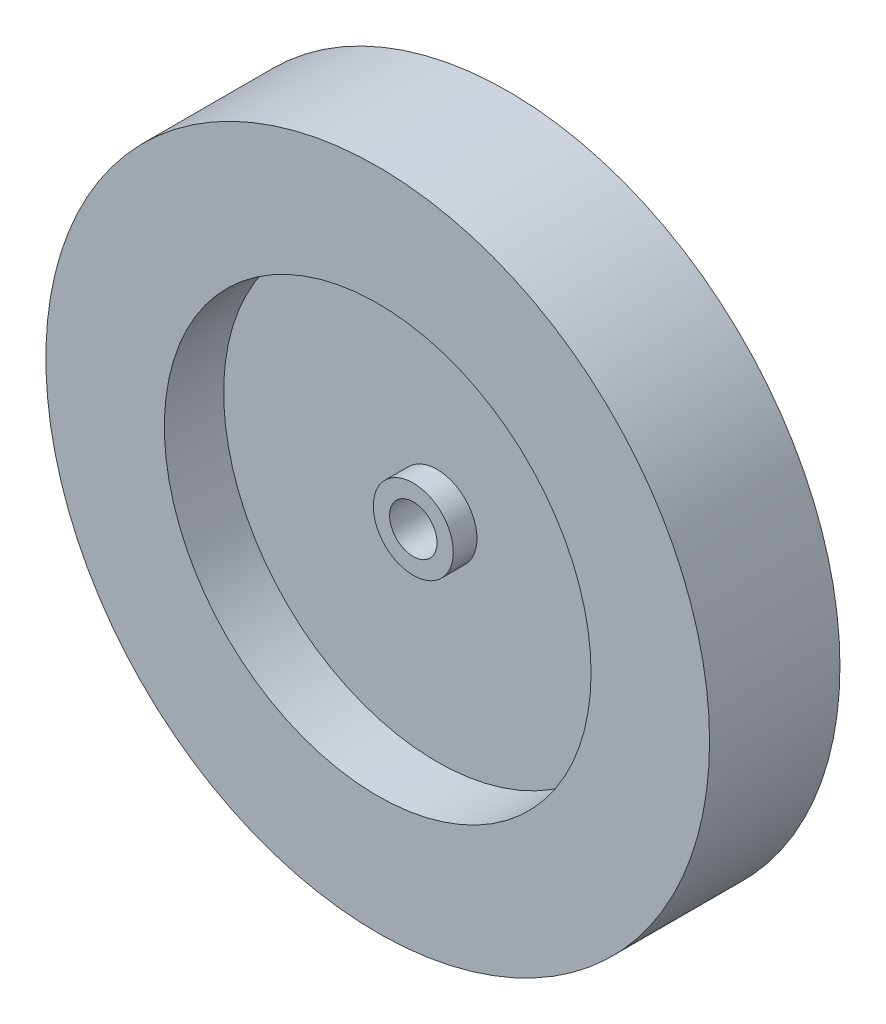
from build123d import *

# Parameters (mm, degrees)
SKETCH1_R               = 88.9
SKETCH1_R_2             = 69.85
BOSS_EXTRUDE1_DEPTH     = 17.4625
SKETCH2_R               = 69.85
BOSS_EXTRUDE2_DEPTH     = 1.5875
SKETCH3_R               = 69.85
SKETCH3_R_2             = 57.15
BOSS_EXTRUDE3_DEPTH     = 17.4625
SKETCH4_R               = 10.715625
BOSS_EXTRUDE4_DEPTH     = 7.9375
SKETCH5_R               = 9.525
BOSS_EXTRUDE5_DEPTH     = 25.4
CUT_EXTRUDE1_DEPTH      = 129.263712717
CUT_EXTRUDE1_DEPTH_BACK = 129.263712717
SKETCH6_R               = 6.35


with BuildPart() as part:
    # Sketch1 → Boss-Extrude1 (new, symmetric)
    with BuildSketch(Plane.XY):
        Circle(SKETCH1_R)
        Circle(SKETCH1_R_2, mode=Mode.SUBTRACT)
    extrude(amount=BOSS_EXTRUDE1_DEPTH, both=True)

    # Sketch2 → Boss-Extrude2 (add, symmetric)
    with BuildSketch(Plane.XY):
        Circle(SKETCH2_R)
    extrude(amount=BOSS_EXTRUDE2_DEPTH, both=True)



with BuildPart() as body_2:
    # Sketch3 → Boss-Extrude3 (new, symmetric)
    with BuildSketch(Plane.XY):
        Circle(SKETCH3_R)
        Circle(SKETCH3_R_2, mode=Mode.SUBTRACT)
    extrude(amount=BOSS_EXTRUDE3_DEPTH, both=True)


with BuildPart() as part_1:
    add(part.part)

    add(body_2.part)  # Boss-Extrude4 merges body 2
    # Sketch4 → Boss-Extrude4 (add)
    with BuildSketch(Plane.XY):
        Circle(SKETCH4_R)
    extrude(amount=BOSS_EXTRUDE4_DEPTH)

    # Sketch5 → Boss-Extrude5 (add)
    with BuildSketch(Plane.XY):
        Circle(SKETCH5_R)
    extrude(amount=-BOSS_EXTRUDE5_DEPTH)

    # Sketch6 → Cut-Extrude1 (cut, two sides: drawn at the far end of the back side and taken through both)
    with BuildSketch(Plane.XY.offset(-CUT_EXTRUDE1_DEPTH_BACK)):
        Circle(SKETCH6_R)
    extrude(amount=CUT_EXTRUDE1_DEPTH + CUT_EXTRUDE1_DEPTH_BACK, mode=Mode.SUBTRACT)


solid = part_1.part
